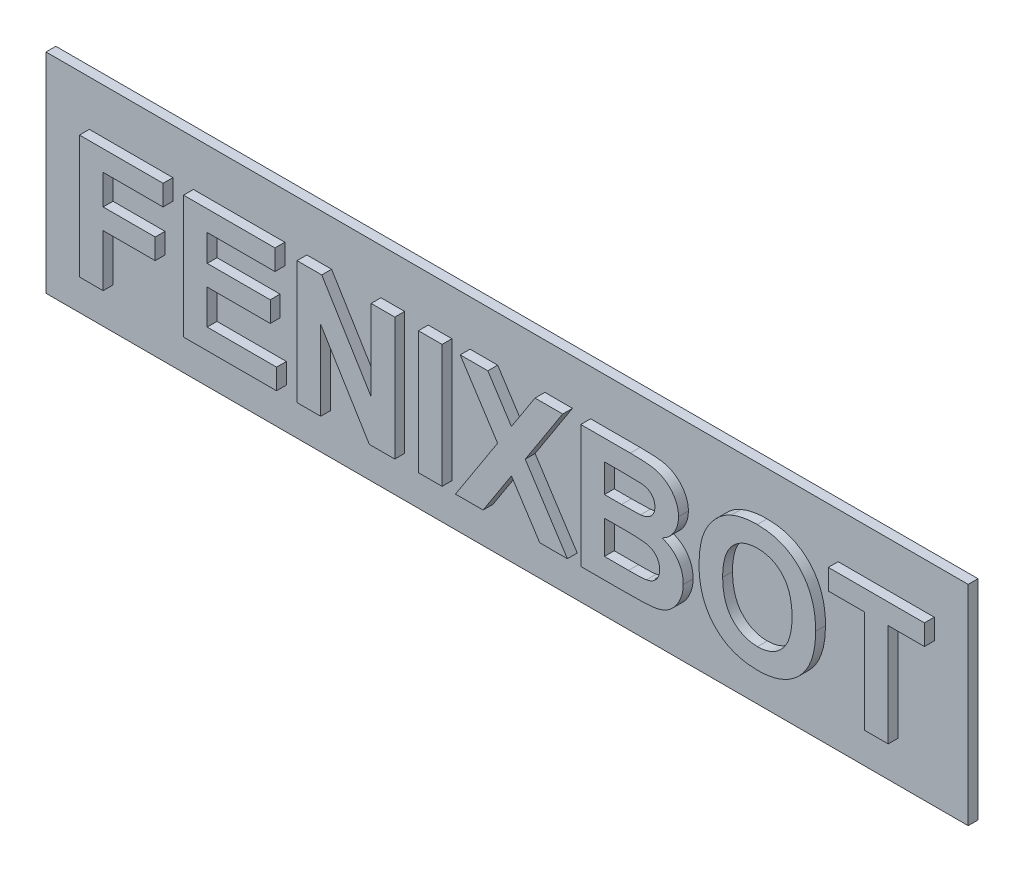
from build123d import *

# Parameters (mm, degrees)
SALIENTE_EXTRUIR1_DEPTH   = 0.8
SALIENTE_EXTRUIR1_2_DEPTH = 0.8
SALIENTE_EXTRUIR1_3_DEPTH = 0.8
CROQUIS1_W                = 1.923076923
CROQUIS1_H                = 10
SALIENTE_EXTRUIR1_4_DEPTH = 0.8
SALIENTE_EXTRUIR1_5_DEPTH = 0.8
SALIENTE_EXTRUIR1_6_DEPTH = 0.8
SALIENTE_EXTRUIR1_7_DEPTH = 0.8
SALIENTE_EXTRUIR1_8_DEPTH = 0.8
CROQUIS2_W                = 75
CROQUIS2_H                = 17
SALIENTE_EXTRUIR2_DEPTH   = 0.8


with BuildPart() as part:
    # Croquis1 → Saliente-Extruir1 (new body)
    with BuildSketch(Plane.XY):
        Polygon((-33.974358974, 0), (-33.974358974, 10), (-27.179487179, 10), (-27.179487179, 8.333333333), (-32.051282051, 8.333333333), (-32.051282051, 5.897435897), (-27.820512821, 5.897435897), (-27.820512821, 4.230769231), (-32.051282051, 4.230769231), (-32.051282051, 0), align=None)
    extrude(amount=SALIENTE_EXTRUIR1_DEPTH)



with BuildPart() as body_2:
    # Croquis1 → Saliente-Extruir1 2 (new body)
    with BuildSketch(Plane.XY):
        Polygon((-25.512820513, 0), (-25.512820513, 10), (-18.076923077, 10), (-18.076923077, 8.333333333), (-23.58974359, 8.333333333), (-23.58974359, 6.153846154), (-18.461538462, 6.153846154), (-18.461538462, 4.487179487), (-23.58974359, 4.487179487), (-23.58974359, 1.666666667), (-17.948717949, 1.666666667), (-17.948717949, 0), align=None)
    extrude(amount=SALIENTE_EXTRUIR1_2_DEPTH)


with BuildPart() as body_3:
    # Croquis1 → Saliente-Extruir1 3 (new body)
    with BuildSketch(Plane.XY):
        Polygon((-16.282051282, 0), (-16.282051282, 10), (-14.272836538, 10), (-10.256410256, 3.425480769), (-10.256410256, 10), (-8.333333333, 10), (-8.333333333, 0), (-10.404647436, 0), (-14.358974359, 6.470352564), (-14.358974359, 0), align=None)
    extrude(amount=SALIENTE_EXTRUIR1_3_DEPTH)


with BuildPart() as body_4:
    # Croquis1 → Saliente-Extruir1 4 (new body)
    with BuildSketch(Plane.XY):
        with Locations((-5.448717949, 5)):
            Rectangle(CROQUIS1_W, CROQUIS1_H)
    extrude(amount=SALIENTE_EXTRUIR1_4_DEPTH)


with BuildPart() as body_5:
    # Croquis1 → Saliente-Extruir1 5 (new body)
    with BuildSketch(Plane.XY):
        Polygon((-3.397435897, 0), (0.030048077, 5.296474359), (-3.012820513, 10), (-0.765224359, 10), (1.153846154, 7.033253205), (3.072916667, 10), (5.320512821, 10), (2.277644231, 5.296474359), (5.705128205, 0), (3.457532051, 0), (1.153846154, 3.559695513), (-1.149839744, 0), align=None)
    extrude(amount=SALIENTE_EXTRUIR1_5_DEPTH)


with BuildPart() as body_6:
    # Croquis1 → Saliente-Extruir1 6 (new body)
    with BuildSketch(Plane.XY):
        with BuildLine():
            Line((6.794871795, 10), (10.823317308, 10))
            add(Edge.make_bspline(
                [(10.823317308, 10), (10.920138042, 9.99942392), (11.107109966, 9.998311444), (11.378269894, 9.995211097), (11.629959848, 9.986106129), (11.862571757, 9.978287746), (12.075331983, 9.960003799), (12.269912683, 9.945638779), (12.445701226, 9.925876251), (12.652784708, 9.893894612), (12.89358622, 9.84414943), (13.165565632, 9.7521343), (13.423375445, 9.637170395), (13.663140534, 9.491011383), (13.885657345, 9.320069231), (14.092627687, 9.125705508), (14.27450449, 8.900066147), (14.438281679, 8.653798242), (14.576521331, 8.386694953), (14.671716453, 8.099344997), (14.732467301, 7.797016974), (14.739830657, 7.589774349), (14.743589744, 7.483974359)],
                knots=[0, 0, 0, 0, 1.096610875, 2.117681168, 3.071055591, 3.949137991, 4.753059115, 5.489127199, 6.15892391, 6.75575099, 7.862330316, 8.938514814, 10.001276227, 11.05313779, 12.110449801, 13.174958802, 14.260456508, 15.384725817, 16.521138801, 17.654729897, 18.802709851, 20, 20, 20, 20], degree=3))
            add(Edge.make_bspline(
                [(14.743589744, 7.483974359), (14.73969104, 7.368760849), (14.73200366, 7.141585365), (14.660451169, 6.808455096), (14.546476365, 6.489726724), (14.385560313, 6.190570793), (14.188470852, 5.916042016), (13.955346954, 5.67497244), (13.689613937, 5.468827814), (13.490079699, 5.366249597), (13.389423077, 5.314503205)],
                knots=[0, 0, 0, 0, 1.023065178, 2.01725758, 3.014298905, 4.023406433, 5.026736079, 6.009055718, 6.99565244, 8, 8, 8, 8], degree=3))
            add(Edge.make_bspline(
                [(13.389423077, 5.314503205), (13.457217238, 5.29141184), (13.591263734, 5.245754272), (13.783130666, 5.161913926), (13.962899593, 5.064684561), (14.130480241, 4.957132139), (14.28714449, 4.838470415), (14.428315226, 4.704764849), (14.562092902, 4.563622319), (14.679539327, 4.407957889), (14.785846365, 4.245216752), (14.876085152, 4.072851674), (14.954224428, 3.895008481), (15.019573751, 3.709887282), (15.066156411, 3.516246477), (15.103481339, 3.316525434), (15.12257573, 3.109339957), (15.126313258, 2.969448439), (15.128205128, 2.898637821)],
                knots=[0, 0, 0, 0, 1.072651974, 2.1209089, 3.132484228, 4.131466326, 5.101889999, 6.071643115, 7.041396231, 8.011819904, 8.988565287, 9.95070344, 10.922775742, 11.897213062, 12.887138018, 13.903598663, 14.938838629, 16, 16, 16, 16], degree=3))
            add(Edge.make_bspline(
                [(15.128205128, 2.898637821), (15.124181347, 2.785558124), (15.116152359, 2.559920732), (15.056152748, 2.223317855), (14.954819215, 1.892643156), (14.817592695, 1.570041832), (14.647142221, 1.265854924), (14.446751684, 0.988132822), (14.212948674, 0.746487846), (13.954032067, 0.533563428), (13.662272052, 0.357292372), (13.337917904, 0.221891466), (12.983019325, 0.119598742), (12.732994958, 0.085617994), (12.604166667, 0.068108974)],
                knots=[0, 0, 0, 0, 0.975059807, 1.945618526, 2.93861228, 3.952760547, 4.963632603, 5.940527786, 6.897802811, 7.855787948, 8.824773195, 9.82606706, 10.879852914, 12, 12, 12, 12], degree=3))
            add(Edge.make_bspline(
                [(12.604166667, 0.068108974), (12.554766804, 0.063941829), (12.441365619, 0.054375828), (12.249043515, 0.042482688), (12.012573952, 0.0334928), (11.732162261, 0.022863395), (11.406945206, 0.015188654), (11.037661917, 0.009947843), (10.623682296, 0.003146304), (10.333202693, 0.001085073), (10.180288462, 0)],
                knots=[0, 0, 0, 0, 0.490565993, 1.126131979, 1.906526787, 2.832178623, 3.902933831, 5.125497984, 6.486805064, 8, 8, 8, 8], degree=3))
            Line((10.180288462, 0), (6.794871795, 0))
            Line((6.794871795, 0), (6.794871795, 10))
        make_face()
        with BuildLine():
            Line((8.717948718, 8.333333333), (8.717948718, 6.025641026))
            Line((8.717948718, 6.025641026), (10.110176282, 6.025641026))
            add(Edge.make_bspline(
                [(10.110176282, 6.025641026), (10.208334204, 6.025424773), (10.395304183, 6.025012858), (10.661056962, 6.027773172), (10.898118569, 6.029061808), (11.105807446, 6.032843759), (11.284080953, 6.039085381), (11.432296745, 6.045318145), (11.551311302, 6.050037069), (11.620610717, 6.05677548), (11.650641026, 6.059695513)],
                knots=[0, 0, 0, 0, 1.528479216, 2.911428072, 4.138414629, 5.21998762, 6.145918986, 6.915989543, 7.530253335, 8, 8, 8, 8], degree=3))
            add(Edge.make_bspline(
                [(11.650641026, 6.059695513), (11.737243738, 6.07272725), (11.903688837, 6.09777345), (12.136602125, 6.171164709), (12.338623552, 6.277311607), (12.511995621, 6.409436472), (12.649616873, 6.571538203), (12.750609597, 6.758013872), (12.809697768, 6.96964705), (12.816817865, 7.11834592), (12.820512821, 7.195512821)],
                knots=[0, 0, 0, 0, 1.162079002, 2.233444551, 3.225172046, 4.179556897, 5.110707885, 6.027301426, 6.976273101, 8, 8, 8, 8], degree=3))
            add(Edge.make_bspline(
                [(12.820512821, 7.195512821), (12.818193364, 7.270028015), (12.813740585, 7.413078666), (12.758426754, 7.615618552), (12.675266568, 7.797515599), (12.553708535, 7.954301036), (12.401171972, 8.086708039), (12.214475178, 8.1901361), (11.994514669, 8.261304404), (11.836075762, 8.286196318), (11.752804487, 8.299278846)],
                knots=[0, 0, 0, 0, 1.044241546, 2.004684189, 2.928111627, 3.838334562, 4.769594837, 5.748424953, 6.81663206, 8, 8, 8, 8], degree=3))
            add(Edge.make_bspline(
                [(11.752804487, 8.299278846), (11.720102109, 8.302207724), (11.642787828, 8.309132114), (11.508414649, 8.313633473), (11.33749988, 8.319968841), (11.129172322, 8.326151835), (10.883426342, 8.329926899), (10.600960849, 8.331199224), (10.281788458, 8.333971592), (10.056758229, 8.333553934), (9.937900641, 8.333333333)],
                knots=[0, 0, 0, 0, 0.433943041, 1.02591908, 1.776648879, 2.694999143, 3.780816848, 5.02540149, 6.428861738, 8, 8, 8, 8], degree=3))
            Line((9.937900641, 8.333333333), (8.717948718, 8.333333333))
        make_face(mode=Mode.SUBTRACT)
        with BuildLine():
            Line((8.717948718, 4.358974359), (8.717948718, 1.666666667))
            Line((8.717948718, 1.666666667), (10.681089744, 1.666666667))
            add(Edge.make_bspline(
                [(10.681089744, 1.666666667), (10.772573978, 1.666212858), (10.946204549, 1.66535156), (11.19389951, 1.671120419), (11.415016899, 1.673022623), (11.610591643, 1.682512826), (11.779596034, 1.689692067), (11.922725474, 1.698642195), (12.038862411, 1.712875484), (12.107397624, 1.723925502), (12.137419872, 1.728766026)],
                knots=[0, 0, 0, 0, 1.504773752, 2.85595359, 4.075347731, 5.141676974, 6.076328919, 6.858106537, 7.499786952, 8, 8, 8, 8], degree=3))
            add(Edge.make_bspline(
                [(12.137419872, 1.728766026), (12.213660992, 1.744852388), (12.361791547, 1.776106937), (12.567098585, 1.865792088), (12.752136208, 1.97952914), (12.912393096, 2.125705081), (13.04411595, 2.300819839), (13.139229217, 2.505259123), (13.196588919, 2.73661761), (13.202198152, 2.899626099), (13.205128205, 2.984775641)],
                knots=[0, 0, 0, 0, 1.031056579, 2.003262591, 2.954260215, 3.900917722, 4.862741126, 5.841340256, 6.872396835, 8, 8, 8, 8], degree=3))
            add(Edge.make_bspline(
                [(13.205128205, 2.984775641), (13.202763578, 3.057798704), (13.198161106, 3.199929569), (13.153109068, 3.403504748), (13.080230039, 3.589639094), (12.978736882, 3.757062413), (12.851933604, 3.907877393), (12.695179244, 4.034088435), (12.514202696, 4.139241964), (12.341678739, 4.208515925), (12.178081311, 4.252959298), (12.022043706, 4.282115022), (11.833986503, 4.305193988), (11.614821398, 4.324716237), (11.363659034, 4.340327891), (11.08117442, 4.352635092), (10.766579263, 4.357786141), (10.54620797, 4.358565709), (10.430689103, 4.358974359)],
                knots=[0, 0, 0, 0, 0.992165387, 1.931134082, 2.820086661, 3.700270762, 4.583075858, 5.486803518, 6.423132184, 7.421722103, 8.005700193, 8.727213115, 9.57900282, 10.582332745, 11.720121093, 13.002085041, 14.428489784, 16, 16, 16, 16], degree=3))
            Line((10.430689103, 4.358974359), (8.717948718, 4.358974359))
        make_face(mode=Mode.SUBTRACT)
    extrude(amount=SALIENTE_EXTRUIR1_6_DEPTH)


with BuildPart() as body_7:
    # Croquis1 → Saliente-Extruir1 7 (new body)
    with BuildSketch(Plane.XY):
        with BuildLine():
            add(Edge.make_bspline(
                [(16.41025641, 4.939903846), (16.410964069, 5.063479719), (16.412353821, 5.306166782), (16.436434984, 5.662197814), (16.468175834, 6.003466852), (16.519865756, 6.328631559), (16.580671976, 6.639213816), (16.656724419, 6.935121434), (16.748340682, 7.215316671), (16.821222144, 7.394218301), (16.856971154, 7.481971154)],
                knots=[0, 0, 0, 0, 1.141009212, 2.240794809, 3.294380675, 4.305229195, 5.280013876, 6.216333343, 7.125095522, 8, 8, 8, 8], degree=3))
            add(Edge.make_bspline(
                [(16.856971154, 7.481971154), (16.915407218, 7.606721999), (17.031592044, 7.854756414), (17.247365526, 8.205248983), (17.491932046, 8.535791874), (17.763278154, 8.844652246), (18.054476298, 9.127180378), (18.366900217, 9.368983778), (18.689450426, 9.578228661), (18.918856851, 9.683466401), (19.032451923, 9.735576923)],
                knots=[0, 0, 0, 0, 1.031372299, 2.050613973, 3.077158538, 4.108712802, 5.127684358, 6.111366908, 7.06480644, 8, 8, 8, 8], degree=3))
            add(Edge.make_bspline(
                [(19.032451923, 9.735576923), (19.109559832, 9.767204867), (19.265414578, 9.831133006), (19.507631197, 9.910918673), (19.7590382, 9.975740921), (20.017817176, 10.033684458), (20.286480653, 10.073638434), (20.562857717, 10.107138469), (20.848460885, 10.12469642), (21.04164649, 10.127022839), (21.139823718, 10.128205128)],
                knots=[0, 0, 0, 0, 0.92659354, 1.872881803, 2.832850937, 3.813025581, 4.820167273, 5.851730198, 6.908245912, 8, 8, 8, 8], degree=3))
            add(Edge.make_bspline(
                [(21.139823718, 10.128205128), (21.315617647, 10.123798552), (21.659648783, 10.115174821), (22.162181663, 10.052886638), (22.637730348, 9.947707307), (23.084685099, 9.795684188), (23.506899421, 9.60565199), (23.901092959, 9.369938688), (24.267849129, 9.091095421), (24.606459559, 8.772946026), (24.911402505, 8.416044956), (25.176982477, 8.023726202), (25.399768168, 7.597828203), (25.583245048, 7.139526032), (25.724233205, 6.64732273), (25.826097017, 6.122607097), (25.886612368, 5.564992638), (25.893763342, 5.182444419), (25.897435897, 4.985977564)],
                knots=[0, 0, 0, 0, 1.064641025, 2.083517118, 3.061799897, 4.009540929, 4.938075217, 5.861300345, 6.78508344, 7.723570974, 8.670267188, 9.622657076, 10.586935816, 11.576069104, 12.607749008, 13.683335114, 14.81022093, 16, 16, 16, 16], degree=3))
            add(Edge.make_bspline(
                [(25.897435897, 4.985977564), (25.893848167, 4.790826279), (25.886863526, 4.410903187), (25.825218619, 3.857664352), (25.727577931, 3.336773911), (25.583178422, 2.849421767), (25.405177557, 2.391889098), (25.180099346, 1.969625484), (24.920081419, 1.577029874), (24.615571589, 1.223974693), (24.282660165, 0.903999438), (23.916369206, 0.628415148), (23.525045203, 0.392382467), (23.105132873, 0.201801106), (22.659369128, 0.052908849), (22.186299247, -0.053078708), (21.685680605, -0.115127198), (21.342989922, -0.12378224), (21.16786859, -0.128205128)],
                knots=[0, 0, 0, 0, 1.18845052, 2.313691126, 3.386664782, 4.412527756, 5.405809582, 6.372003093, 7.321919452, 8.268293321, 9.206237639, 10.129603466, 11.054616372, 11.9847576, 12.932764752, 13.912672021, 14.933336461, 16, 16, 16, 16], degree=3))
            add(Edge.make_bspline(
                [(21.16786859, -0.128205128), (20.990746913, -0.123772034), (20.644068906, -0.115095194), (20.1381107, -0.053235576), (19.660344795, 0.05278687), (19.211111404, 0.202202857), (18.787346674, 0.389889056), (18.39296306, 0.623509823), (18.027742558, 0.900839439), (17.692049463, 1.217048305), (17.387727922, 1.569065499), (17.128079188, 1.959136827), (16.902989237, 2.377275981), (16.724052531, 2.829816767), (16.580448179, 3.312103121), (16.482568897, 3.826910156), (16.42080479, 4.372820988), (16.413836805, 4.747421173), (16.41025641, 4.939903846)],
                knots=[0, 0, 0, 0, 1.080878253, 2.11558926, 3.1052859, 4.062802436, 5.000434901, 5.928596448, 6.853693179, 7.793554778, 8.738606028, 9.68692032, 10.647726704, 11.63151566, 12.651483354, 13.714466703, 14.825613081, 16, 16, 16, 16], degree=3))
        make_face()
        with BuildLine():
            add(Edge.make_bspline(
                [(18.333333333, 5.006009615), (18.335254463, 4.867683196), (18.338974694, 4.599816717), (18.378600084, 4.211015007), (18.438734799, 3.847539935), (18.527171732, 3.509804037), (18.638894963, 3.197562986), (18.775779083, 2.910555596), (18.937258402, 2.648354398), (19.127509592, 2.416494831), (19.333346463, 2.209488929), (19.555529001, 2.030376616), (19.789916506, 1.876213557), (20.040564593, 1.754502343), (20.302256828, 1.657911179), (20.577026376, 1.586292368), (20.866239455, 1.546966607), (21.063590434, 1.541326972), (21.163862179, 1.538461538)],
                knots=[0, 0, 0, 0, 1.313550922, 2.543666373, 3.708465049, 4.810029406, 5.85539231, 6.85404609, 7.825601258, 8.772642133, 9.696587791, 10.59409323, 11.479048685, 12.35559886, 13.234601248, 14.125357077, 15.047515647, 16, 16, 16, 16], degree=3))
            add(Edge.make_bspline(
                [(21.163862179, 1.538461538), (21.264147434, 1.541268914), (21.461524998, 1.546794282), (21.750382723, 1.586924111), (22.025696791, 1.655473187), (22.286349399, 1.751569378), (22.533528567, 1.875213218), (22.767019, 2.025920265), (22.9854748, 2.20584746), (23.19108762, 2.409846084), (23.376203473, 2.643245638), (23.536307927, 2.905401587), (23.673124604, 3.194149685), (23.784859602, 3.509597954), (23.871120082, 3.852339903), (23.928800554, 4.22255688), (23.968746371, 4.619190319), (23.97245143, 4.893055408), (23.974358974, 5.034054487)],
                knots=[0, 0, 0, 0, 0.949153107, 1.868086493, 2.754172764, 3.630100905, 4.492260106, 5.365378617, 6.254840125, 7.166615376, 8.102436631, 9.067266169, 10.06813181, 11.121736829, 12.23011542, 13.408501285, 14.665770308, 16, 16, 16, 16], degree=3))
            add(Edge.make_bspline(
                [(23.974358974, 5.034054487), (23.972204379, 5.173692145), (23.968031799, 5.444113739), (23.931692944, 5.835740054), (23.872176613, 6.200088273), (23.789442337, 6.53706401), (23.680103792, 6.846721564), (23.549511697, 7.129907724), (23.391607306, 7.385142998), (23.210510317, 7.612295231), (23.010118159, 7.812232991), (22.793835428, 7.987269935), (22.560433283, 8.132911313), (22.312189688, 8.255448773), (22.046520172, 8.346358868), (21.766124557, 8.412667925), (21.470209342, 8.453501143), (21.267492632, 8.458819615), (21.163862179, 8.461538462)],
                knots=[0, 0, 0, 0, 1.332337092, 2.580197383, 3.749299508, 4.852775005, 5.886662144, 6.878700295, 7.822989687, 8.743523536, 9.644687758, 10.519443927, 11.392806431, 12.264866173, 13.155606721, 14.065961015, 15.011303331, 16, 16, 16, 16], degree=3))
            add(Edge.make_bspline(
                [(21.163862179, 8.461538462), (21.060218628, 8.458861436), (20.857476295, 8.453624774), (20.561099817, 8.412115503), (20.279820866, 8.347782287), (20.014188899, 8.251681215), (19.763783024, 8.130320503), (19.529529424, 7.97980903), (19.309582254, 7.805069139), (19.107394641, 7.602099863), (18.923363311, 7.372958487), (18.765382877, 7.114604497), (18.630669849, 6.829859441), (18.520145619, 6.517880447), (18.438212988, 6.17780928), (18.37524094, 5.811931425), (18.339878174, 5.418032375), (18.335561836, 5.14630236), (18.333333333, 5.006009615)],
                knots=[0, 0, 0, 0, 0.981996942, 1.920933313, 2.83127778, 3.712125466, 4.592427284, 5.463259035, 6.34592384, 7.249932058, 8.173122297, 9.125107726, 10.113123258, 11.154048744, 12.256187849, 13.424658091, 14.670364834, 16, 16, 16, 16], degree=3))
        make_face(mode=Mode.SUBTRACT)
    extrude(amount=SALIENTE_EXTRUIR1_7_DEPTH)


with BuildPart() as body_8:
    # Croquis1 → Saliente-Extruir1 8 (new body)
    with BuildSketch(Plane.XY):
        Polygon((29.871794872, 0), (29.871794872, 8.333333333), (26.923076923, 8.333333333), (26.923076923, 10), (34.743589744, 10), (34.743589744, 8.333333333), (31.794871795, 8.333333333), (31.794871795, 0), align=None)
    extrude(amount=SALIENTE_EXTRUIR1_8_DEPTH)


with BuildPart() as part_1:
    add(part.part)

    add(body_2.part)  # Saliente-Extruir2 merges body 2

    add(body_3.part)  # Saliente-Extruir2 merges body 3

    add(body_6.part)  # Saliente-Extruir2 merges body 6

    add(body_7.part)  # Saliente-Extruir2 merges body 7

    add(body_8.part)  # Saliente-Extruir2 merges body 8
    # Croquis2 → Saliente-Extruir2 (add)
    with BuildSketch(Plane.XY):
        with Locations((0, 5.190472921)):
            Rectangle(CROQUIS2_W, CROQUIS2_H)
    extrude(amount=-SALIENTE_EXTRUIR2_DEPTH)


solid = Compound([body_4.part, body_5.part, part_1.part])
